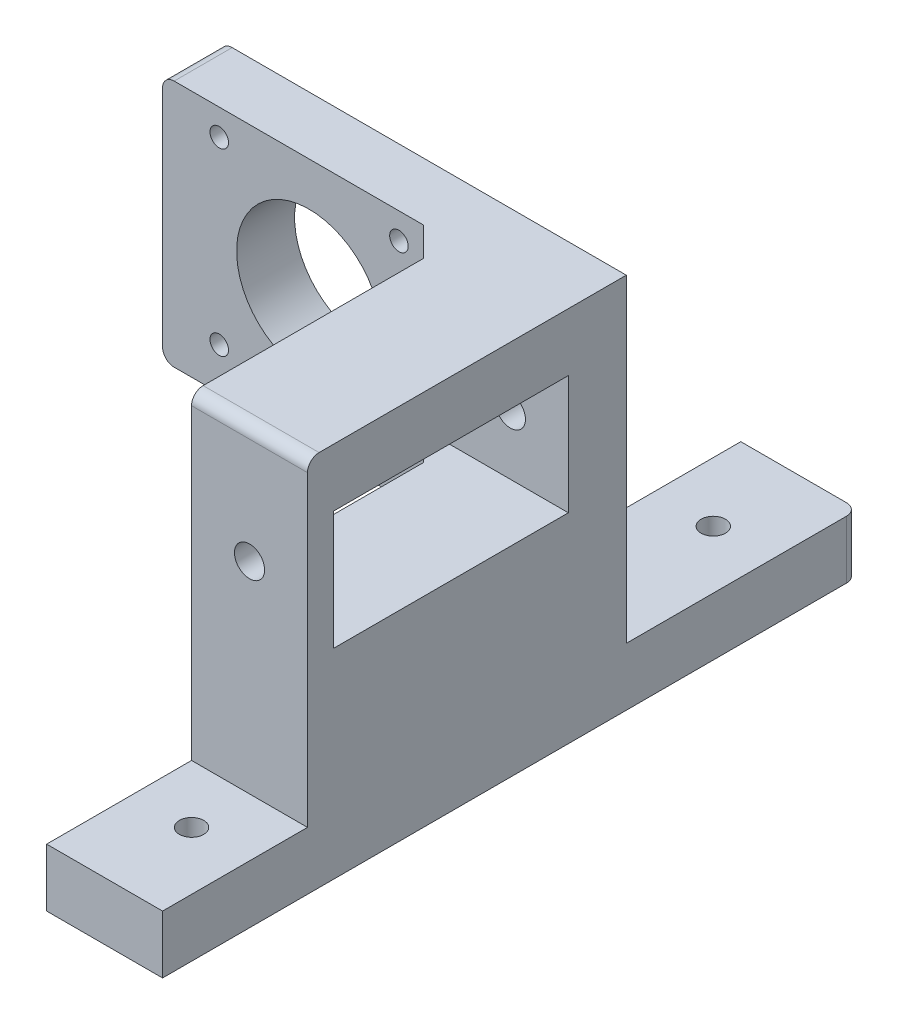
from build123d import *

# Parameters (mm, degrees)
SKETCH4_W           = 20
SKETCH4_H           = 120
BOSS_EXTRUDE4_DEPTH = 10
SKETCH5_R           = 2.1
CUT_EXTRUDE1_DEPTH  = 10
SKETCH8_W           = 20
SKETCH8_H           = 55
BOSS_EXTRUDE6_DEPTH = 55
SKETCH9_W           = 40.5
SKETCH9_H           = 20.5
CUT_EXTRUDE2_DEPTH  = 20
SKETCH11_R          = 2.6
CUT_EXTRUDE3_DEPTH  = 50
SKETCH12_W          = 10
SKETCH12_H          = 55
BOSS_EXTRUDE7_DEPTH = 50
SKETCH15_R          = 12.5
CUT_EXTRUDE4_DEPTH  = 10
SKETCH17_W          = 50
SKETCH17_H          = 12.25
CUT_EXTRUDE6_DEPTH  = 10
CHAMFER1_SIZE       = 12.5
FILLET1_R           = 2
CHAMFER2_SIZE       = 5


with BuildPart() as part:
    # Sketch4 → Boss-Extrude4 (new body)
    with BuildSketch(Plane(origin=(0, 0, 0), x_dir=(1, 0, 0), z_dir=(0, 1, 0))):
        with Locations((10, 60)):
            Rectangle(SKETCH4_W, SKETCH4_H)
    extrude(amount=BOSS_EXTRUDE4_DEPTH)

    # Sketch5 → Cut-Extrude1 (cut)
    with BuildSketch(Plane(origin=(0, 10, 0), x_dir=(1, 0, 0), z_dir=(0, 1, 0))):
        with Locations(Location((10, 105, 0), (0, 0, 270))):
            Circle(SKETCH5_R)
        with Locations(Location((10, 15, 0), (0, 0, 270))):
            Circle(SKETCH5_R)
    extrude(amount=-CUT_EXTRUDE1_DEPTH, mode=Mode.SUBTRACT)

    # Sketch8 → Boss-Extrude6 (add)
    with BuildSketch(Plane(origin=(0, 10, 0), x_dir=(1, 0, 0), z_dir=(0, 1, 0))):
        with Locations((10, 52.5)):
            Rectangle(SKETCH8_W, SKETCH8_H)
    extrude(amount=BOSS_EXTRUDE6_DEPTH)

    # Sketch9 → Cut-Extrude2 (cut)
    with BuildSketch(Plane.ZY):
        with Locations((-49.75, 44.75)):
            Rectangle(SKETCH9_W, SKETCH9_H)
    extrude(amount=-CUT_EXTRUDE2_DEPTH, mode=Mode.SUBTRACT)

    # Sketch11 → Cut-Extrude3 (cut, symmetric)
    with BuildSketch(Plane.XY.offset(-70)):
        with Locations((10, 44.75)):
            Circle(SKETCH11_R)
    extrude(amount=CUT_EXTRUDE3_DEPTH, both=True, mode=Mode.SUBTRACT)

    # Sketch12 → Boss-Extrude7 (add)
    with BuildSketch(Plane.ZY):
        with Locations((-75, 37.5)):
            Rectangle(SKETCH12_W, SKETCH12_H)
    extrude(amount=BOSS_EXTRUDE7_DEPTH)

    # Sketch15 → Cut-Extrude4 (cut)
    with BuildSketch(Plane.XY.offset(-70)):
        with Locations((-24.72528445, 45.000219356)):
            Circle(SKETCH15_R)
        with BuildLine():
            ThreePointArc((-7.62528445, 60.500219356), (-9.22528445, 62.100219356), (-10.82528445, 60.500219356))
            Line((-10.82528445, 60.500219356), (-9.22528445, 60.500219356))
            Line((-9.22528445, 60.500219356), (-9.22528445, 58.900219356))
            ThreePointArc((-9.22528445, 58.900219356), (-8.0939136, 59.368848506), (-7.62528445, 60.500219356))
        make_face()
        with BuildLine():
            Line((-9.22528445, 60.500219356), (-10.82528445, 60.500219356))
            ThreePointArc((-10.82528445, 60.500219356), (-10.3566553, 59.368848506), (-9.22528445, 58.900219356))
            Line((-9.22528445, 58.900219356), (-9.22528445, 60.500219356))
        make_face()
        with BuildLine():
            ThreePointArc((-7.62528445, 29.500219356), (-8.0939136, 30.631590206), (-9.22528445, 31.100219356))
            Line((-9.22528445, 31.100219356), (-9.22528445, 29.500219356))
            Line((-9.22528445, 29.500219356), (-10.82528445, 29.500219356))
            ThreePointArc((-10.82528445, 29.500219356), (-9.22528445, 27.900219356), (-7.62528445, 29.500219356))
        make_face()
        with BuildLine():
            Line((-9.22528445, 29.500219356), (-9.22528445, 31.100219356))
            ThreePointArc((-9.22528445, 31.100219356), (-10.3566553, 30.631590206), (-10.82528445, 29.500219356))
            Line((-10.82528445, 29.500219356), (-9.22528445, 29.500219356))
        make_face()
        with BuildLine():
            ThreePointArc((-38.62528445, 29.500219356), (-39.0939136, 30.631590206), (-40.22528445, 31.100219356))
            Line((-40.22528445, 31.100219356), (-40.22528445, 29.500219356))
            Line((-40.22528445, 29.500219356), (-38.62528445, 29.500219356))
        make_face()
        with BuildLine():
            Line((-40.22528445, 29.500219356), (-40.22528445, 31.100219356))
            ThreePointArc((-40.22528445, 31.100219356), (-41.3566553, 28.368848506), (-38.62528445, 29.500219356))
            Line((-38.62528445, 29.500219356), (-40.22528445, 29.500219356))
        make_face()
        with BuildLine():
            Line((-40.22528445, 58.900219356), (-40.22528445, 60.500219356))
            Line((-40.22528445, 60.500219356), (-38.62528445, 60.500219356))
            ThreePointArc((-38.62528445, 60.500219356), (-41.3566553, 61.631590206), (-40.22528445, 58.900219356))
        make_face()
        with BuildLine():
            Line((-38.62528445, 60.500219356), (-40.22528445, 60.500219356))
            Line((-40.22528445, 60.500219356), (-40.22528445, 58.900219356))
            ThreePointArc((-40.22528445, 58.900219356), (-39.0939136, 59.368848506), (-38.62528445, 60.500219356))
        make_face()
    extrude(amount=-CUT_EXTRUDE4_DEPTH, mode=Mode.SUBTRACT)

    # Sketch17 → Cut-Extrude6 (cut)
    with BuildSketch(Plane.XY.offset(-70)):
        with Locations((-25, 16.125)):
            Rectangle(SKETCH17_W, SKETCH17_H)
    extrude(amount=-CUT_EXTRUDE6_DEPTH, mode=Mode.SUBTRACT)

    # Chamfer1
    chamfer1_edges = [part.edges().sort_by_distance(p)[0] for p in [
        (0, 22.25, -75),
    ]]
    chamfer(chamfer1_edges, length=CHAMFER1_SIZE)

    # Fillet1
    fillet1_edges = [part.edges().sort_by_distance(p)[0] for p in [
        (-50, 22.25, -75),
        (0, 4.875, -120),
        (10, 65, -25),
        (-50, 65, -75),
        (20, 5, -120),
    ]]
    fillet(fillet1_edges, radius=FILLET1_R)

    # Chamfer2
    chamfer2_edges = [part.edges().sort_by_distance(p)[0] for p in [
        (0, 22.125, -70),
        (0, 60, -70),
    ]]
    chamfer(chamfer2_edges, length=CHAMFER2_SIZE)


solid = part.part
